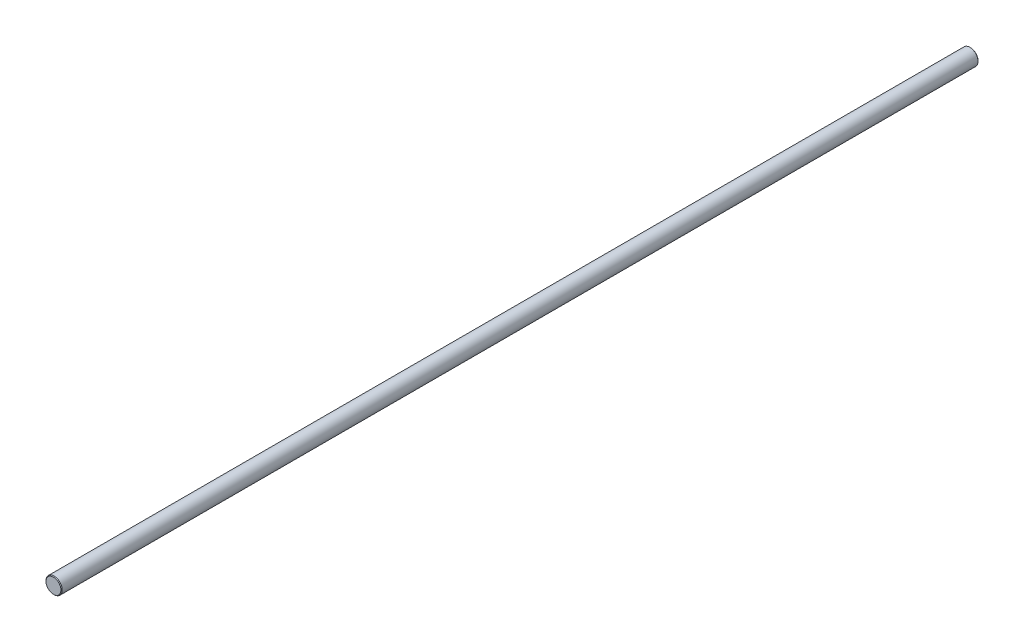
from build123d import *

# Parameters (mm, degrees)
SKETCH_1_R      = 12.5
EXTRUDE_1_DEPTH = 707
CHAMFER_1_SIZE  = 1


with BuildPart() as part:
    # Эскиз1 → Бобышка-Вытянуть1 (new, symmetric)
    with BuildSketch(Plane.XY):
        Circle(SKETCH_1_R)
    extrude(amount=EXTRUDE_1_DEPTH, both=True)

    # Фаска1
    chamfer_1_edges = [part.edges().sort_by_distance(p)[0] for p in [
        (-12.5, 0, -707),
        (-12.5, 0, 707),
    ]]
    chamfer(chamfer_1_edges, length=CHAMFER_1_SIZE)


solid = part.part
